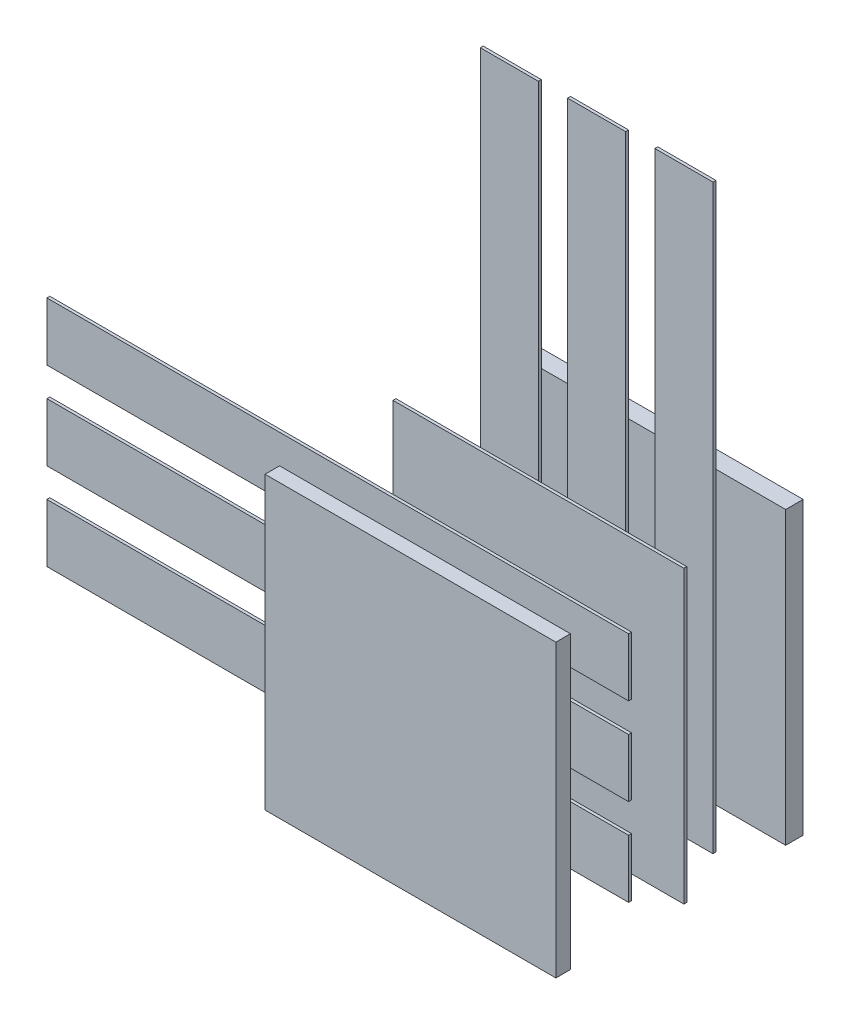
from build123d import *

# Parameters (mm, degrees)
SZKIC1_W                      = 100
SZKIC1_H                      = 100
DODANIE_WYCI_GNI_CIE1_DEPTH   = 6
DODANIE_WYCI_GNI_CIE2_START   = 40
SZKIC1_2_W                    = 100
SZKIC1_2_H                    = 100
DODANIE_WYCI_GNI_CIE2_DEPTH   = 1
DODANIE_WYCI_GNI_CIE3_START   = 80
SZKIC1_3_W                    = 100
SZKIC1_3_H                    = 100
DODANIE_WYCI_GNI_CIE3_DEPTH   = 5
DODANIE_WYCI_GNI_CIE5_START   = 20
SZKIC2_W                      = 20
SZKIC2_H                      = 200
DODANIE_WYCI_GNI_CIE5_DEPTH   = 1
DODANIE_WYCI_GNI_CIE5_2_DEPTH = 1
DODANIE_WYCI_GNI_CIE5_3_DEPTH = 1
DODANIE_WYCI_GNI_CIE6_START   = -60
SZKIC4_W                      = 200
SZKIC4_H                      = 20
DODANIE_WYCI_GNI_CIE6_DEPTH   = 1
DODANIE_WYCI_GNI_CIE6_2_DEPTH = 1
DODANIE_WYCI_GNI_CIE6_3_DEPTH = 1


with BuildPart() as part:
    # Szkic1 → Dodanie-wyciągnięcie1 (new body)
    with BuildSketch(Plane.XY):
        Rectangle(SZKIC1_W, SZKIC1_H)
    extrude(amount=DODANIE_WYCI_GNI_CIE1_DEPTH)


with BuildPart() as body_2:
    # Szkic1<2> → Dodanie-wyciągnięcie2 (new body)
    with BuildSketch(Plane.XY.offset(DODANIE_WYCI_GNI_CIE2_START)):
        Rectangle(SZKIC1_2_W, SZKIC1_2_H)
    extrude(amount=DODANIE_WYCI_GNI_CIE2_DEPTH)


with BuildPart() as body_3:
    # Szkic1<3> → Dodanie-wyciągnięcie3 (new body)
    with BuildSketch(Plane.XY.offset(DODANIE_WYCI_GNI_CIE3_START)):
        Rectangle(SZKIC1_3_W, SZKIC1_3_H)
    extrude(amount=DODANIE_WYCI_GNI_CIE3_DEPTH)


with BuildPart() as body_4:
    # Szkic2 → Dodanie-wyciągnięcie5 (new body)
    with BuildSketch(Plane.XY.offset(DODANIE_WYCI_GNI_CIE5_START)):
        with Locations((0, 50)):
            Rectangle(SZKIC2_W, SZKIC2_H)
    extrude(amount=DODANIE_WYCI_GNI_CIE5_DEPTH)


with BuildPart() as body_5:
    # Szkic2 → Dodanie-wyci_gni_cie5 2 (new body)
    with BuildSketch(Plane.XY.offset(DODANIE_WYCI_GNI_CIE5_START)):
        with Locations((-30, 50)):
            Rectangle(SZKIC2_W, SZKIC2_H)
    extrude(amount=DODANIE_WYCI_GNI_CIE5_2_DEPTH)


with BuildPart() as body_6:
    # Szkic2 → Dodanie-wyci_gni_cie5 3 (new body)
    with BuildSketch(Plane.XY.offset(DODANIE_WYCI_GNI_CIE5_START)):
        with Locations((30, 50)):
            Rectangle(SZKIC2_W, SZKIC2_H)
    extrude(amount=DODANIE_WYCI_GNI_CIE5_3_DEPTH)


with BuildPart() as body_7:
    # Szkic4 → Dodanie-wyciągnięcie6 (new body)
    with BuildSketch(Plane(origin=(0, 0, 0), x_dir=(-1, 0, 0), z_dir=(0, 0, -1)).offset(DODANIE_WYCI_GNI_CIE6_START)):
        with Locations((50, 0)):
            Rectangle(SZKIC4_W, SZKIC4_H)
    extrude(amount=DODANIE_WYCI_GNI_CIE6_DEPTH)


with BuildPart() as body_8:
    # Szkic4 → Dodanie-wyci_gni_cie6 2 (new body)
    with BuildSketch(Plane(origin=(0, 0, 0), x_dir=(-1, 0, 0), z_dir=(0, 0, -1)).offset(DODANIE_WYCI_GNI_CIE6_START)):
        with Locations((50, -30)):
            Rectangle(SZKIC4_W, SZKIC4_H)
    extrude(amount=DODANIE_WYCI_GNI_CIE6_2_DEPTH)


with BuildPart() as body_9:
    # Szkic4 → Dodanie-wyci_gni_cie6 3 (new body)
    with BuildSketch(Plane(origin=(0, 0, 0), x_dir=(-1, 0, 0), z_dir=(0, 0, -1)).offset(DODANIE_WYCI_GNI_CIE6_START)):
        with Locations((50, 30)):
            Rectangle(SZKIC4_W, SZKIC4_H)
    extrude(amount=DODANIE_WYCI_GNI_CIE6_3_DEPTH)


solid = Compound([part.part, body_2.part, body_3.part, body_4.part, body_5.part, body_6.part, body_7.part, body_8.part, body_9.part])
